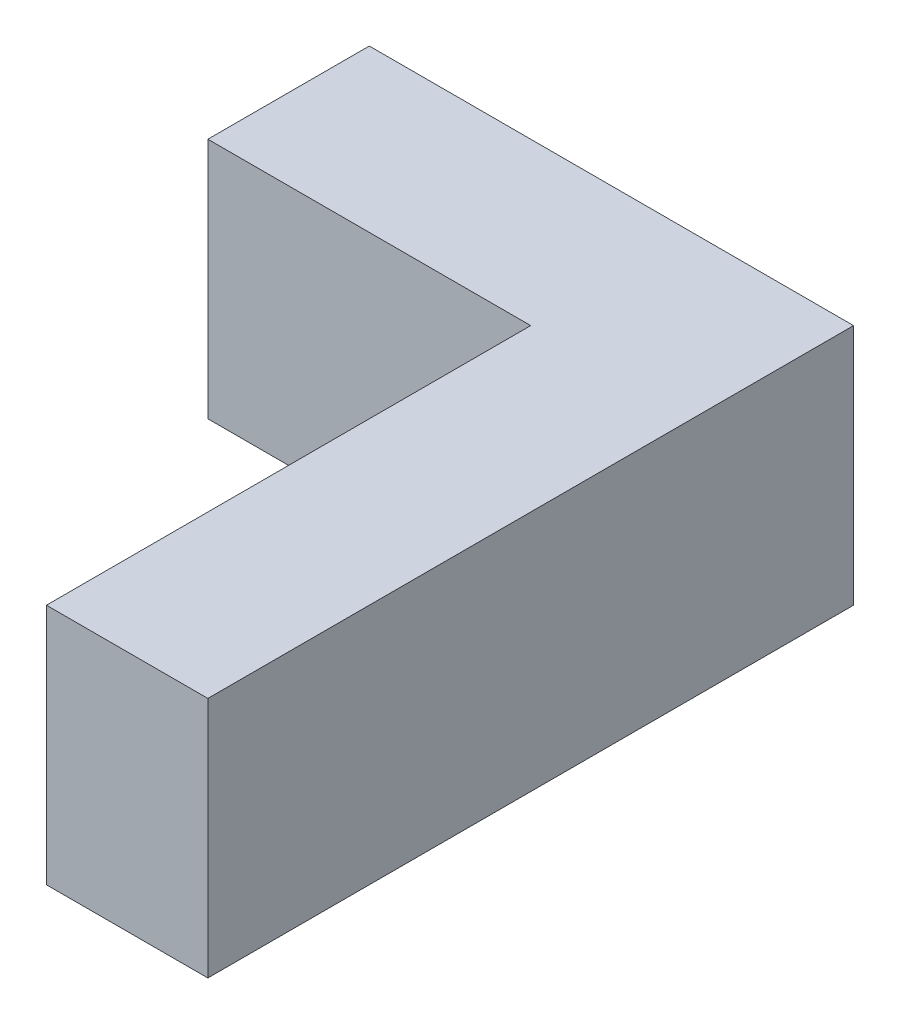
from build123d import *

# Parameters (mm, degrees)
SKETCH1_W           = 30
SKETCH1_H           = 40
BOSS_EXTRUDE1_DEPTH = 15
CUT_EXTRUDE1_REACH  = 31.155
SKETCH2_W           = 20
SKETCH2_H           = 30


with BuildPart() as part:
    # Sketch1 → Boss-Extrude1 (new body)
    with BuildSketch(Plane(origin=(0, 0, 0), x_dir=(1, 0, 0), z_dir=(0, 1, 0))):
        Rectangle(SKETCH1_W, SKETCH1_H)
    extrude(amount=BOSS_EXTRUDE1_DEPTH)

    # Sketch2 → Cut-Extrude1 (cut, up to next)
    with BuildSketch(Plane(origin=(0, 15, 0), x_dir=(1, 0, 0), z_dir=(0, 1, 0)), mode=Mode.PRIVATE) as cut_extrude1_sk1:
        with Locations((-5, -5)):
            Rectangle(SKETCH2_W, SKETCH2_H)
    cut_extrude1_tool1 = extrude(cut_extrude1_sk1.sketch, amount=-CUT_EXTRUDE1_REACH, mode=Mode.PRIVATE) & part.part
    add(cut_extrude1_tool1.solids().sort_by_distance((-5, 15, 5))[0], mode=Mode.SUBTRACT)


solid = part.part
